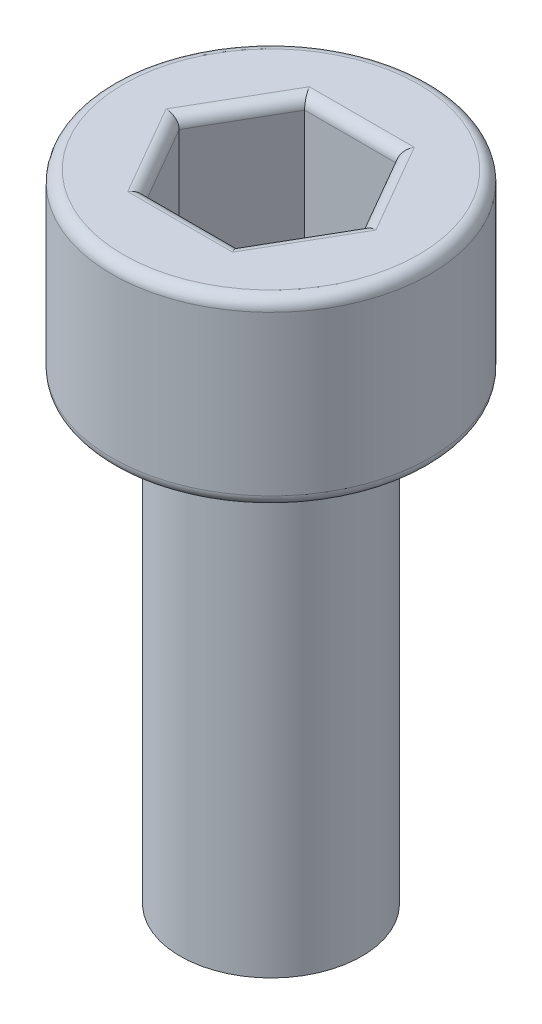
from build123d import *

# Parameters (mm, degrees)
CUT_EXTRUDE1_DEPTH = 3
FILLET1_R          = 0.25


with BuildPart() as part:
    # Sketch2 → Revolve1 (revolve)
    with BuildSketch(Plane.XY, mode=Mode.PRIVATE) as revolve1_sk:
        Polygon((0, 4), (3.5, 4), (3.5, 0), (2, 0), (2, -10), (0, -10), align=None)
    revolve(revolve1_sk.sketch.rotate(Axis((0, 21.322324325, 0), (0, -1, 0)), 180), axis=Axis((0, 21.322324325, 0), (0, -1, 0)))

    # Sketch3 → Cut-Extrude1 (cut)
    with BuildSketch(Plane(origin=(0, 4, 0), x_dir=(1, 0, 0), z_dir=(0, 1, 0))):
        Polygon((2.020725942, 0), (1.010362971, 1.75), (-1.010362971, 1.75), (-2.020725942, 0), (-1.010362971, -1.75), (1.010362971, -1.75), align=None)
    extrude(amount=-CUT_EXTRUDE1_DEPTH, mode=Mode.SUBTRACT)

    # Fillet1
    fillet1_edges = [part.edges().sort_by_distance(p)[0] for p in [
        (1.515544457, 4, 0.875),
        (1.515544457, 4, -0.875),
        (0, 4, -1.75),
        (-1.515544457, 4, -0.875),
        (-1.515544457, 4, 0.875),
        (0, 4, 1.75),
        (2, 0, 0),
        (3.5, 0, 0),
        (3.5, 4, 0),
    ]]
    fillet(fillet1_edges, radius=FILLET1_R)


solid = part.part
